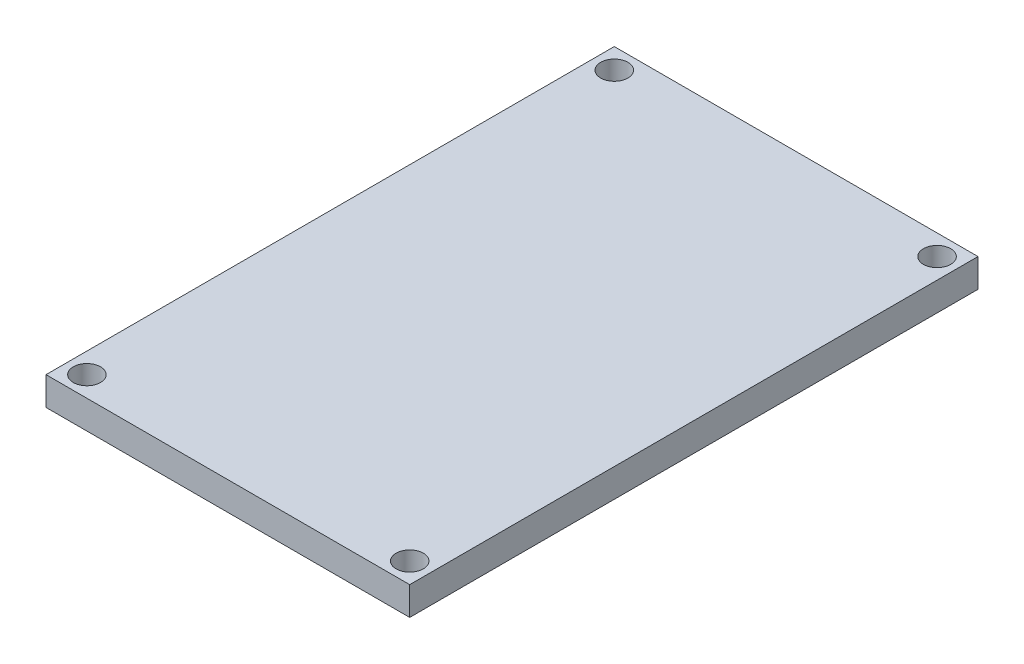
from build123d import *

# Parameters (mm, degrees)
SKETCH1_W           = 40.64
SKETCH1_H           = 63.5
SKETCH1_R           = 1.524
BOSS_EXTRUDE1_DEPTH = 3.175


with BuildPart() as part:
    # Sketch1 → Boss-Extrude1 (new body)
    with BuildSketch(Plane(origin=(0, 0, 0), x_dir=(1, 0, 0), z_dir=(0, 1, 0))):
        with Locations((20.32, 31.75)):
            Rectangle(SKETCH1_W, SKETCH1_H)
        with Locations((2.286, 2.286)):
            Circle(SKETCH1_R, mode=Mode.SUBTRACT)
        with Locations((38.354, 2.286)):
            Circle(SKETCH1_R, mode=Mode.SUBTRACT)
        with Locations((2.286, 61.214)):
            Circle(SKETCH1_R, mode=Mode.SUBTRACT)
        with Locations((38.354, 61.214)):
            Circle(SKETCH1_R, mode=Mode.SUBTRACT)
    extrude(amount=BOSS_EXTRUDE1_DEPTH)


solid = part.part
